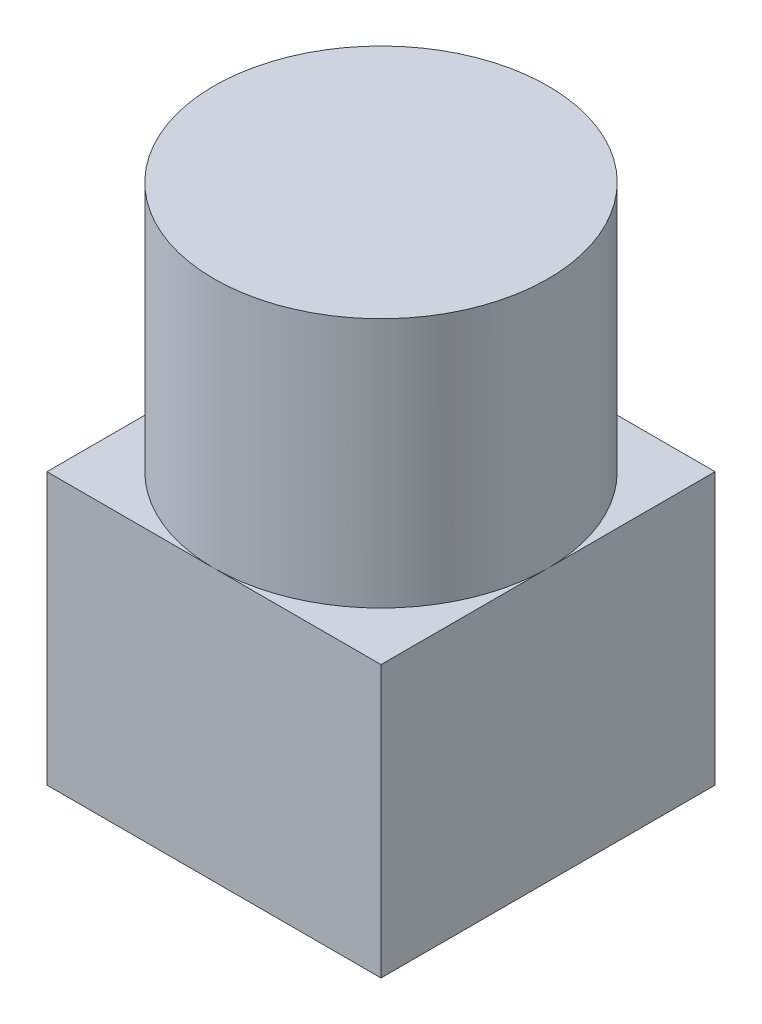
from build123d import *

# Parameters (mm, degrees)
SZKIC1_W                    = 8
SZKIC1_H                    = 8
DODANIE_WYCI_GNI_CIE1_DEPTH = 6.5
SZKIC2_R                    = 4
DODANIE_WYCI_GNI_CIE2_DEPTH = 6


with BuildPart() as part:
    # Szkic1 → Dodanie-wyciągnięcie1 (new body)
    with BuildSketch(Plane(origin=(0, 0, 0), x_dir=(1, 0, 0), z_dir=(0, 1, 0))):
        Rectangle(SZKIC1_W, SZKIC1_H)
    extrude(amount=DODANIE_WYCI_GNI_CIE1_DEPTH)

    # Szkic2 → Dodanie-wyciągnięcie2 (add)
    with BuildSketch(Plane(origin=(0, 6.5, 0), x_dir=(1, 0, 0), z_dir=(0, 1, 0))):
        with Locations(Location((0, 0, 0), (0, 0, 270))):
            Circle(SZKIC2_R)
    extrude(amount=DODANIE_WYCI_GNI_CIE2_DEPTH)


solid = part.part
